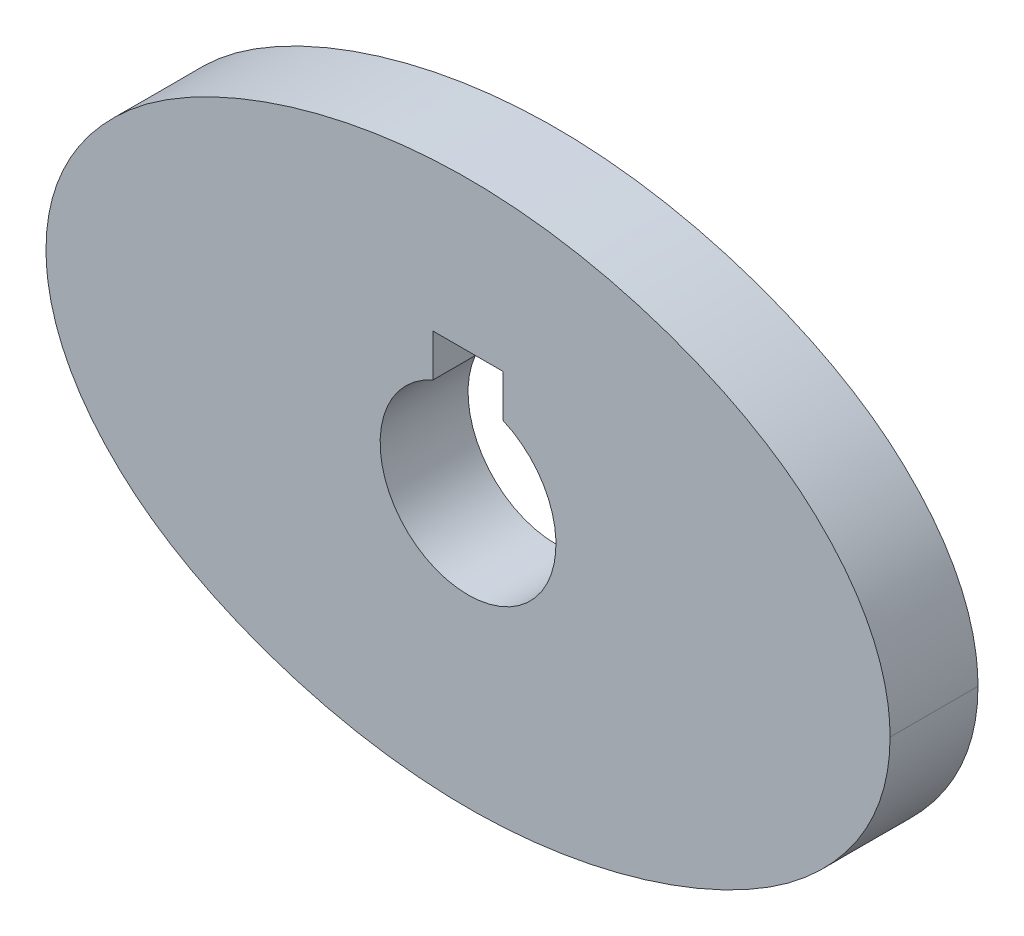
from build123d import *

# Parameters (mm, degrees)
CROQUIS1_R              = 5
SALIENTE_EXTRUIR1_DEPTH = 5
CORTAR_EXTRUIR1_START   = -10
CORTAR_EXTRUIR1_DEPTH   = 10


with BuildPart() as part:
    # Croquis1 → Saliente-Extruir1 (new body)
    with BuildSketch(Plane(origin=(0, 0, 0), x_dir=(-1, 0, 0), z_dir=(0, 0, -1))):
        with BuildLine():
            add(Edge.make_bspline(
                [(24, 0), (24, 2.583333333), (23.04, 5.993333333), (15.36, 12.606666667), (8, 15.5), (-8, 15.5), (-15.36, 12.606666667), (-23.04, 5.993333333), (-24, 2.583333333), (-24, 0)],
                knots=[0, 0, 0, 0, 0.25, 0.25, 0.5, 0.5, 0.75, 0.75, 1, 1, 1, 1], degree=3))
            add(Edge.make_bspline(
                [(-24, 0), (-24, -2.583333333), (-23.04, -5.993333333), (-15.36, -12.606666667), (-8, -15.5), (8, -15.5), (15.36, -12.606666667), (23.04, -5.993333333), (24, -2.583333333), (24, 0)],
                knots=[0, 0, 0, 0, 0.25, 0.25, 0.5, 0.5, 0.75, 0.75, 1, 1, 1, 1], degree=3))
        make_face()
        with Locations(Location((0, 0, 0), (0, 0, 180))):
            Circle(CROQUIS1_R, mode=Mode.SUBTRACT)
    extrude(amount=-SALIENTE_EXTRUIR1_DEPTH)

    # Croquis3 → Cortar-Extruir1 (cut)
    with BuildSketch(Plane.XY.offset(5).offset(CORTAR_EXTRUIR1_START)):
        with BuildLine():
            Line((-2, 7), (-2, 4.582575695))
            ThreePointArc((-2, 4.582575695), (0, 5), (2, 4.582575695))
            Line((2, 4.582575695), (2, 7))
            Line((2, 7), (-2, 7))
        make_face()
    extrude(amount=CORTAR_EXTRUIR1_DEPTH, mode=Mode.SUBTRACT)


solid = part.part
